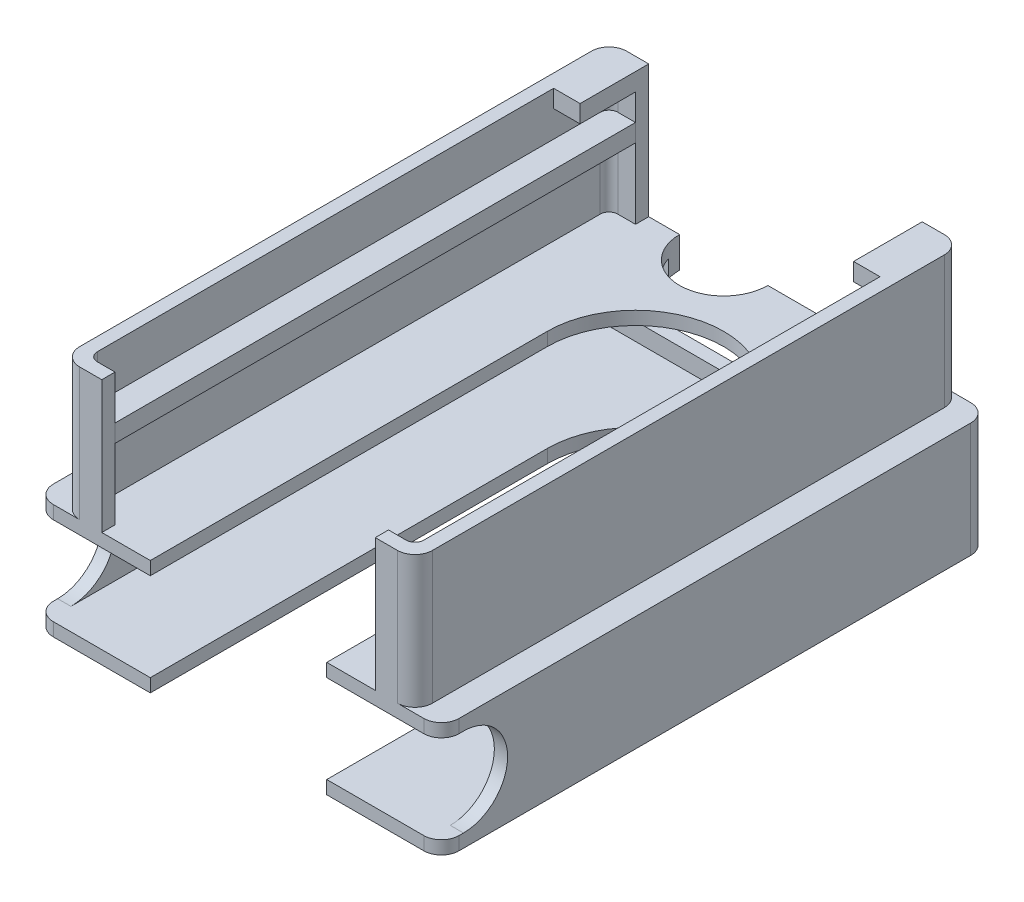
from build123d import *

# Parameters (mm, degrees)
BASE_EXTRUDE_DEPTH          = 0.75
SIDEWALL_EXTRUDE_DEPTH      = 5.75
TOP_EXTRUDE_START           = 5.75
TOP_EXTRUDE_DEPTH           = 0.75
CUT_EXTRUDE1_DEPTH          = 29.901773302
CUT_EXTRUDE1_DEPTH_BACK     = 29.901773302
PCB_SUPPORT_EXTRUDE_START   = 4
PCB_SUPPORT_EXTRUDE_DEPTH   = 1
PCB_SUPPORT_EXTRUDE_2_DEPTH = 1
PCB_RIM_EXTRUDE_DEPTH       = 7.5
CUT_EXTRUDE2_DEPTH          = 22.2735164
CUT_EXTRUDE3_DEPTH          = 3.5
CUT_EXTRUDE4_DEPTH          = 2
BOSS_EXTRUDE1_START         = 6.5
BOSS_EXTRUDE1_DEPTH         = 1


with BuildPart() as part:
    # battery-base → base-extrude (new body)
    with BuildSketch(Plane(origin=(0, 0, 0), x_dir=(1, 0, 0), z_dir=(0, 1, 0))):
        with BuildLine():
            Line((-10.5, 16.25), (10.5, 16.25))
            ThreePointArc((10.5, 16.25), (11.207106781, 15.957106781), (11.5, 15.25))
            Line((11.5, 15.25), (11.5, -13.75))
            ThreePointArc((11.5, -13.75), (11.207106781, -14.457106781), (10.5, -14.75))
            Line((10.5, -14.75), (-10.5, -14.75))
            ThreePointArc((-10.5, -14.75), (-11.207106781, -14.457106781), (-11.5, -13.75))
            Line((-11.5, -13.75), (-11.5, 15.25))
            ThreePointArc((-11.5, 15.25), (-11.207106781, 15.957106781), (-10.5, 16.25))
        make_face()
    extrude(amount=BASE_EXTRUDE_DEPTH)

    # battery-base<12> → sidewall-extrude (add)
    with BuildSketch(Plane(origin=(0, 0, 0), x_dir=(1, 0, 0), z_dir=(0, 1, 0))):
        with BuildLine():
            Line((-11.5, -13.5), (-10.75, -13.5))
            Line((-10.75, -13.5), (-10.75, 15))
            ThreePointArc((-10.75, 15), (-10.603553391, 15.353553391), (-10.25, 15.5))
            Line((-10.25, 15.5), (10.25, 15.5))
            ThreePointArc((10.25, 15.5), (10.603553391, 15.353553391), (10.75, 15))
            Line((10.75, 15), (10.75, -13.5))
            Line((10.75, -13.5), (11.5, -13.5))
            Line((11.5, -13.5), (11.5, 15.25))
            ThreePointArc((11.5, 15.25), (11.207106781, 15.957106781), (10.5, 16.25))
            Line((10.5, 16.25), (-10.5, 16.25))
            ThreePointArc((-10.5, 16.25), (-11.207106781, 15.957106781), (-11.5, 15.25))
            Line((-11.5, 15.25), (-11.5, -13.5))
        make_face()
    extrude(amount=SIDEWALL_EXTRUDE_DEPTH)

    # battery-base<13> → top-extrude (add)
    with BuildSketch(Plane(origin=(0, 0, 0), x_dir=(1, 0, 0), z_dir=(0, 1, 0)).offset(TOP_EXTRUDE_START)):
        with BuildLine():
            Line((11.5, -13.75), (11.5, 15.25))
            ThreePointArc((11.5, 15.25), (11.207106781, 15.957106781), (10.5, 16.25))
            Line((10.5, 16.25), (-10.5, 16.25))
            ThreePointArc((-10.5, 16.25), (-11.207106781, 15.957106781), (-11.5, 15.25))
            Line((-11.5, 15.25), (-11.5, -13.75))
            ThreePointArc((-11.5, -13.75), (-11.207106781, -14.457106781), (-10.5, -14.75))
            Line((-10.5, -14.75), (10.5, -14.75))
            ThreePointArc((10.5, -14.75), (11.207106781, -14.457106781), (11.5, -13.75))
        make_face()
    extrude(amount=TOP_EXTRUDE_DEPTH)

    # round-cut → Cut-Extrude1 (cut, two sides: drawn at the far end of the back side and taken through both)
    with BuildSketch(Plane(origin=(11.5, 0, 0), x_dir=(0, 0, -1), z_dir=(1, 0, 0)).offset(-CUT_EXTRUDE1_DEPTH_BACK)):
        with BuildLine():
            Line((-84.101155105, 0.75), (-13.5, 0.75))
            ThreePointArc((-13.5, 0.75), (-11, 3.25), (-13.5, 5.75))
            Line((-13.5, 5.75), (-84.101155105, 5.75))
            Line((-84.101155105, 5.75), (-225.303465314, 5.75))
            Line((-225.303465314, 5.75), (-225.303465314, 0.75))
            Line((-225.303465314, 0.75), (-84.101155105, 0.75))
        make_face()
    extrude(amount=CUT_EXTRUDE1_DEPTH + CUT_EXTRUDE1_DEPTH_BACK, mode=Mode.SUBTRACT)

    # PCB-support<3> → PCB-rim-extrude (add)
    with BuildSketch(Plane(origin=(0, 6.5, 0), x_dir=(1, 0, 0), z_dir=(0, 1, 0))):
        with BuildLine():
            Line((-7.75, -14.75), (-7.75, -14))
            Line((-7.75, -14), (-8.75, -14))
            ThreePointArc((-8.75, -14), (-9.103553391, -13.853553391), (-9.25, -13.5))
            Line((-9.25, -13.5), (-9.25, 15))
            ThreePointArc((-9.25, 15), (-9.103553391, 15.353553391), (-8.75, 15.5))
            Line((-8.75, 15.5), (-7.75, 15.5))
            Line((-7.75, 15.5), (-7.75, 16.25))
            Line((-7.75, 16.25), (-9, 16.25))
            ThreePointArc((-9, 16.25), (-9.707106781, 15.957106781), (-10, 15.25))
            Line((-10, 15.25), (-10, -13.75))
            ThreePointArc((-10, -13.75), (-9.707106781, -14.457106781), (-9, -14.75))
            Line((-9, -14.75), (-7.75, -14.75))
        make_face()
        with BuildLine():
            Line((8.75, -14), (7.75, -14))
            Line((7.75, -14), (7.75, -14.75))
            Line((7.75, -14.75), (9, -14.75))
            ThreePointArc((9, -14.75), (9.707106781, -14.457106781), (10, -13.75))
            Line((10, -13.75), (10, 15.25))
            ThreePointArc((10, 15.25), (9.707106781, 15.957106781), (9, 16.25))
            Line((9, 16.25), (7.75, 16.25))
            Line((7.75, 16.25), (7.75, 15.5))
            Line((7.75, 15.5), (8.75, 15.5))
            ThreePointArc((8.75, 15.5), (9.103553391, 15.353553391), (9.25, 15))
            Line((9.25, 15), (9.25, -13.5))
            ThreePointArc((9.25, -13.5), (9.103553391, -13.853553391), (8.75, -14))
        make_face()
    extrude(amount=PCB_RIM_EXTRUDE_DEPTH)

    # cut-away → Cut-Extrude2 (cut, through all)
    with BuildSketch(Plane(origin=(0, 6.5, 0), x_dir=(1, 0, 0), z_dir=(0, 1, 0))):
        with BuildLine():
            Line((-5, 7.75), (-5, -14.75))
            Line((-5, -14.75), (5, -14.75))
            Line((5, -14.75), (5, 7.75))
            ThreePointArc((5, 7.75), (0, 12.75), (-5, 7.75))
        make_face()
    extrude(amount=-CUT_EXTRUDE2_DEPTH, mode=Mode.SUBTRACT)

    # Sketch7 → Cut-Extrude3 (cut)
    with BuildSketch(Plane(origin=(0, 0, -16.25), x_dir=(-1, 0, 0), z_dir=(0, 0, -1))):
        with BuildLine():
            Line((8.584888193, 1.75), (-8.584888193, 1.75))
            ThreePointArc((-8.584888193, 1.75), (-10.084888193, 3.25), (-8.584888193, 4.75))
            Line((-8.584888193, 4.75), (8.584888193, 4.75))
            ThreePointArc((8.584888193, 4.75), (10.084888193, 3.25), (8.584888193, 1.75))
        make_face()
    extrude(amount=-CUT_EXTRUDE3_DEPTH, mode=Mode.SUBTRACT)

    # Sketch8 → Cut-Extrude4 (cut)
    with BuildSketch(Plane(origin=(0, 6.5, 0), x_dir=(1, 0, 0), z_dir=(0, 1, 0))):
        with BuildLine():
            Line((-6, 16.25), (-1, 16.25))
            ThreePointArc((-1, 16.25), (-3.5, 13.75), (-6, 16.25))
        make_face()
    extrude(amount=-CUT_EXTRUDE4_DEPTH, mode=Mode.SUBTRACT)

    # PCB-support<4> → Boss-Extrude1 (add)
    with BuildSketch(Plane(origin=(0, 6.5, 0), x_dir=(1, 0, 0), z_dir=(0, 1, 0)).offset(BOSS_EXTRUDE1_START)):
        with BuildLine():
            Line((-9.25, 12.359619479), (-7.75, 12.359619479))
            Line((-7.75, 12.359619479), (-7.75, 15.5))
            Line((-7.75, 15.5), (-8.75, 15.5))
            ThreePointArc((-8.75, 15.5), (-9.103553391, 15.353553391), (-9.25, 15))
            Line((-9.25, 15), (-9.25, 12.359619479))
        make_face()
        with BuildLine():
            Line((7.75, 15.5), (7.75, 12.359619479))
            Line((7.75, 12.359619479), (9.25, 12.359619479))
            Line((9.25, 12.359619479), (9.25, 15))
            ThreePointArc((9.25, 15), (9.103553391, 15.353553391), (8.75, 15.5))
            Line((8.75, 15.5), (7.75, 15.5))
        make_face()
    extrude(amount=BOSS_EXTRUDE1_DEPTH)


with BuildPart() as body_2:
    # PCB-support → PCB-support-extrude (new body)
    with BuildSketch(Plane(origin=(0, 6.5, 0), x_dir=(1, 0, 0), z_dir=(0, 1, 0)).offset(PCB_SUPPORT_EXTRUDE_START)):
        with BuildLine():
            Line((-8.75, -14), (-7.75, -14))
            Line((-7.75, -14), (-7.75, 15.5))
            Line((-7.75, 15.5), (-8.75, 15.5))
            ThreePointArc((-8.75, 15.5), (-9.103553391, 15.353553391), (-9.25, 15))
            Line((-9.25, 15), (-9.25, -13.5))
            ThreePointArc((-9.25, -13.5), (-9.103553391, -13.853553391), (-8.75, -14))
        make_face()
    extrude(amount=PCB_SUPPORT_EXTRUDE_DEPTH)


with BuildPart() as body_3:
    # PCB-support → PCB-support-extrude 2 (new body)
    with BuildSketch(Plane(origin=(0, 6.5, 0), x_dir=(1, 0, 0), z_dir=(0, 1, 0)).offset(PCB_SUPPORT_EXTRUDE_START)):
        with BuildLine():
            Line((7.75, -14), (8.75, -14))
            ThreePointArc((8.75, -14), (9.103553391, -13.853553391), (9.25, -13.5))
            Line((9.25, -13.5), (9.25, 15))
            ThreePointArc((9.25, 15), (9.103553391, 15.353553391), (8.75, 15.5))
            Line((8.75, 15.5), (7.75, 15.5))
            Line((7.75, 15.5), (7.75, -14))
        make_face()
    extrude(amount=PCB_SUPPORT_EXTRUDE_2_DEPTH)


solid = Compound([part.part, body_2.part, body_3.part])
